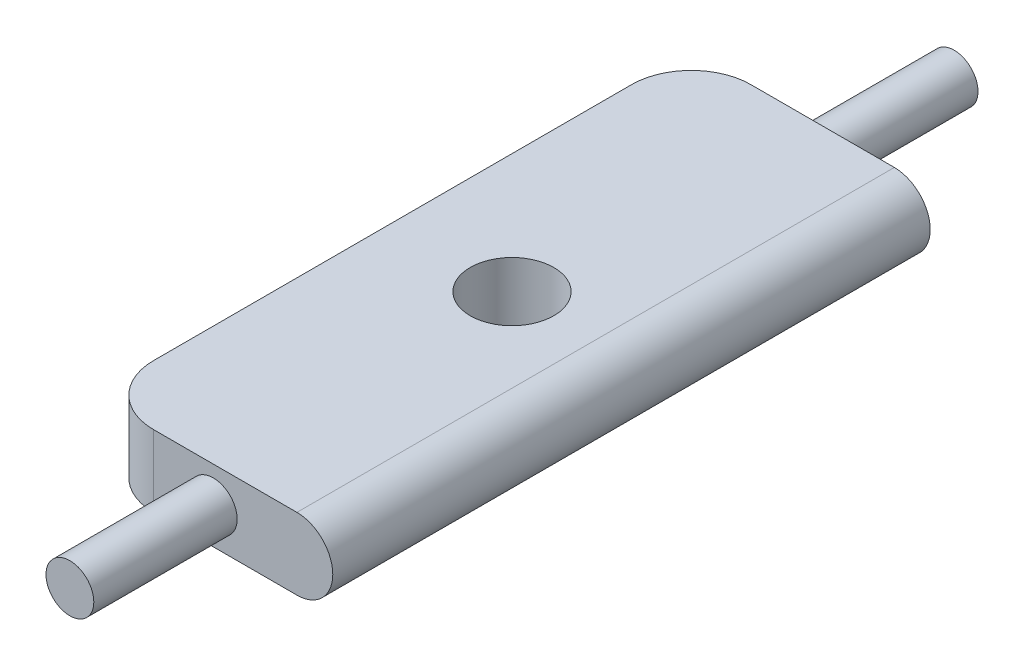
from build123d import *

# Parameters (mm, degrees)
SKETCH1_W           = 20
SKETCH1_H           = 50
BOSS_EXTRUDE1_DEPTH = 6
CUT_EXTRUDE1_DEPTH  = 55.184868737
BOSS_EXTRUDE2_DEPTH = 4
BOSS_EXTRUDE3_START = 4
BOSS_EXTRUDE3_DEPTH = 4
BOSS_EXTRUDE4_START = 1
SKETCH5_R           = 2
BOSS_EXTRUDE4_DEPTH = 1
SKETCH6_R           = 2
BOSS_EXTRUDE5_DEPTH = 1
FILLET1_R           = 5
FILLET2_R           = 5
FILLET3_RADIUS      = 3
FILLET3_LENGTH      = 50
BOSS_EXTRUDE6_START = 7
SKETCH7_R           = 2
BOSS_EXTRUDE6_DEPTH = 7
SKETCH8_R           = 2
BOSS_EXTRUDE7_DEPTH = 7


with BuildPart() as part:
    # Sketch1 → Boss-Extrude1 (new body)
    with BuildSketch(Plane(origin=(0, 0, 0), x_dir=(1, 0, 0), z_dir=(0, 1, 0))):
        with Locations((10, 25)):
            Rectangle(SKETCH1_W, SKETCH1_H)
    extrude(amount=BOSS_EXTRUDE1_DEPTH)

    # Sketch2 → Cut-Extrude1 (cut, through all)
    with BuildSketch(Plane(origin=(0, 6, 0), x_dir=(1, 0, 0), z_dir=(0, 1, 0))):
        with BuildLine():
            ThreePointArc((13.5, 25), (12.474873734, 27.474873734), (10, 28.5))
            Line((10, 28.5), (10, 21.5))
            ThreePointArc((10, 21.5), (12.474873734, 22.525126266), (13.5, 25))
        make_face()
        with BuildLine():
            Line((10, 21.5), (10, 28.5))
            ThreePointArc((10, 28.5), (6.5, 25), (10, 21.5))
        make_face()
    extrude(amount=-CUT_EXTRUDE1_DEPTH, mode=Mode.SUBTRACT)

    # Sketch3 → Boss-Extrude2 (add)
    with BuildSketch(Plane.XY):
        with BuildLine():
            ThreePointArc((12, 3), (11.414213562, 4.414213562), (10, 5))
            Line((10, 5), (10, 1))
            ThreePointArc((10, 1), (11.414213562, 1.585786438), (12, 3))
        make_face()
        with BuildLine():
            Line((10, 1), (10, 5))
            ThreePointArc((10, 5), (8, 3), (10, 1))
        make_face()
    extrude(amount=BOSS_EXTRUDE2_DEPTH)

    # Sketch4 → Boss-Extrude3 (add)
    with BuildSketch(Plane(origin=(0, 0, -50), x_dir=(-1, 0, 0), z_dir=(0, 0, -1)).offset(BOSS_EXTRUDE3_START)):
        with BuildLine():
            ThreePointArc((-8, 3), (-8.585786438, 4.414213562), (-10, 5))
            Line((-10, 5), (-10, 1))
            ThreePointArc((-10, 1), (-8.585786438, 1.585786438), (-8, 3))
        make_face()
        with BuildLine():
            Line((-10, 1), (-10, 5))
            ThreePointArc((-10, 5), (-12, 3), (-10, 1))
        make_face()
    extrude(amount=-BOSS_EXTRUDE3_DEPTH)

    # Sketch5 → Boss-Extrude4 (add)
    with BuildSketch(Plane(origin=(0, 0, -54), x_dir=(-1, 0, 0), z_dir=(0, 0, -1)).offset(BOSS_EXTRUDE4_START)):
        with Locations((-10, 3)):
            Circle(SKETCH5_R)
    extrude(amount=-BOSS_EXTRUDE4_DEPTH)

    # Sketch6 → Boss-Extrude5 (add)
    with BuildSketch(Plane.XY.offset(4)):
        with Locations(Location((10, 3, 0), (0, 0, 180))):
            Circle(SKETCH6_R)
    extrude(amount=BOSS_EXTRUDE5_DEPTH)

    # Fillet1
    fillet1_edges = [part.edges().sort_by_distance(p)[0] for p in [
        (0, 3, -50),
    ]]
    fillet(fillet1_edges, radius=FILLET1_R)

    # Fillet2
    fillet2_edges = [part.edges().sort_by_distance(p)[0] for p in [
        (0, 3, 0),
    ]]
    fillet(fillet2_edges, radius=FILLET2_R)

    # Fillet3: full round fillet: the end face becomes a half cylinder, R = half its width
    fillet3_face = Plane((20, 3, -25), x_dir=(0, 0, 1), z_dir=(1, 0, 0))  # on the end face: x along it, z out of the body
    fillet3_slab = fillet3_face.offset(-FILLET3_RADIUS / 2) * Box(FILLET3_LENGTH, 2 * FILLET3_RADIUS, FILLET3_RADIUS, mode=Mode.PRIVATE)  # the body's end, R deep
    fillet3_round = Plane((17, 3, -25), x_dir=(1, 0, 0), z_dir=(0, 0, 1)) * Cylinder(FILLET3_RADIUS, FILLET3_LENGTH, mode=Mode.PRIVATE)  # its axis R under the face
    add(fillet3_slab - fillet3_round, mode=Mode.SUBTRACT)

    # Sketch7 → Boss-Extrude6 (add)
    with BuildSketch(Plane(origin=(0, 0, -55), x_dir=(-1, 0, 0), z_dir=(0, 0, -1)).offset(BOSS_EXTRUDE6_START)):
        with Locations((-10, 3)):
            Circle(SKETCH7_R)
    extrude(amount=-BOSS_EXTRUDE6_DEPTH)

    # Sketch8 → Boss-Extrude7 (add)
    with BuildSketch(Plane.XY.offset(5)):
        with Locations(Location((10, 3, 0), (0, 0, 180))):
            Circle(SKETCH8_R)
    extrude(amount=BOSS_EXTRUDE7_DEPTH)


solid = part.part
